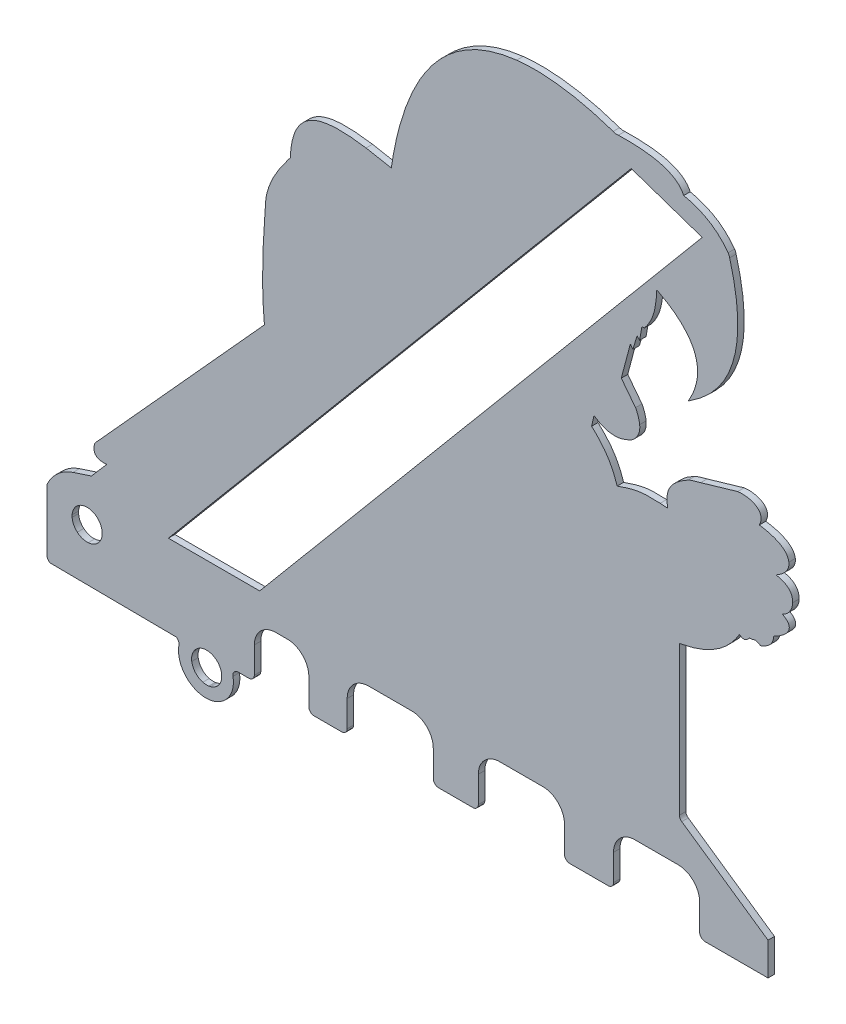
from build123d import *

# Parameters (mm, degrees)
RESSALTO_EXTRUS_O1_DEPTH = 6
ESCALA3_SCALE            = 3.29952381
CORTE_EXTRUS_O1_START    = -13.8
CORTE_EXTRUS_O1_DEPTH    = 13.8
ESBO_O6_W                = 30
ESBO_O6_H                = 66.574449876
CORTE_EXTRUS_O2_DEPTH    = 561.251044592


with BuildPart() as part:
    # Esboço1 → Ressalto-extrusão1 (new body)
    with BuildSketch(Plane.XY):
        with BuildLine():
            Line((-31.121249779, 70.172850718), (-31.713649779, 66.516050718))
            Line((-31.713649779, 66.516050718), (-38.818249779, 67.838550718))
            add(Edge.make_bspline(
                [(-38.818249779, 67.838550718), (-50.072449779, 69.533150718), (-59.326649779, 68.787550718), (-60.104449779, 55.530850718)],
                knots=[0.970588235, 0.970588235, 0.970588235, 0.970588235, 0.980392157, 0.980392157, 0.980392157, 0.980392157], degree=3))
            add(Edge.make_bspline(
                [(-60.104449779, 55.530850718), (-60.159849779, 54.587250718), (-60.019149779, 54.943050718), (-60.550849779, 54.270750718)],
                knots=[0.960784314, 0.960784314, 0.960784314, 0.960784314, 0.970588235, 0.970588235, 0.970588235, 0.970588235], degree=3))
            add(Edge.make_bspline(
                [(-60.550849779, 54.270750718), (-63.682849779, 50.310450718), (-67.043949779, 45.043350718), (-67.148049779, 39.827950718)],
                knots=[0.950980392, 0.950980392, 0.950980392, 0.950980392, 0.960784314, 0.960784314, 0.960784314, 0.960784314], degree=3))
            Line((-67.148049779, 39.827950718), (-67.319449779, 37.295950718))
            add(Edge.make_bspline(
                [(-67.319449779, 37.295950718), (-68.012149779, 28.365950718), (-68.286449779, 19.321950718), (-67.445149779, 10.391650718)],
                knots=[0.931372549, 0.931372549, 0.931372549, 0.931372549, 0.941176471, 0.941176471, 0.941176471, 0.941176471], degree=3))
            Line((-67.445149779, 10.391650718), (-115.167449779, -42.274749282))
            Line((-115.167449779, -42.274749282), (-115.235549779, -42.487349282))
            add(Edge.make_bspline(
                [(-115.235549779, -42.487349282), (-116.043149779, -45.186949282), (-114.385149779, -46.118649282), (-111.823249779, -45.803749282)],
                knots=[0.901960784, 0.901960784, 0.901960784, 0.901960784, 0.911764706, 0.911764706, 0.911764706, 0.911764706], degree=3))
            Line((-111.823249779, -45.803749282), (-116.159149779, -50.830249282))
            Line((-116.159149779, -50.830249282), (-121.346949779, -52.530849282))
            add(Edge.make_bspline(
                [(-121.346949779, -52.530849282), (-124.598549779, -53.596749282), (-127.260549779, -55.993749282), (-128.653149779, -59.137049282)],
                knots=[0.87254902, 0.87254902, 0.87254902, 0.87254902, 0.882352941, 0.882352941, 0.882352941, 0.882352941], degree=3))
            ThreePointArc((-128.653149779, -59.137049282), (-128.675107958, -59.186901913), (-128.696849779, -59.236849282))
            Line((-128.696849779, -59.236849282), (-128.696849779, -76.421849282))
            add(Edge.make_bspline(
                [(-128.696849779, -76.421849282), (-128.696649779, -77.043349282), (-128.316849779, -77.602649282), (-127.738849779, -77.831049282)],
                knots=[0.843137255, 0.843137255, 0.843137255, 0.843137255, 0.852941176, 0.852941176, 0.852941176, 0.852941176], degree=3))
            Line((-127.738849779, -77.831049282), (-92.253149779, -78.140649282))
            add(Edge.make_bspline(
                [(-92.253149779, -78.140649282), (-91.983949779, -78.214149282), (-91.374449779, -78.913749282), (-91.520449779, -79.721949282)],
                knots=[0.823529412, 0.823529412, 0.823529412, 0.823529412, 0.833333333, 0.833333333, 0.833333333, 0.833333333], degree=3))
            add(Edge.make_bspline(
                [(-91.520449779, -79.721949282), (-92.227549779, -83.635649282), (-89.831149779, -87.528149282), (-85.889449779, -88.569949282)],
                knots=[0.81372549, 0.81372549, 0.81372549, 0.81372549, 0.823529412, 0.823529412, 0.823529412, 0.823529412], degree=3))
            add(Edge.make_bspline(
                [(-85.889449779, -88.569949282), (-80.473149779, -90.001549282), (-75.316749779, -85.331049282), (-76.300749779, -79.751649282)],
                knots=[0.803921569, 0.803921569, 0.803921569, 0.803921569, 0.81372549, 0.81372549, 0.81372549, 0.81372549], degree=3))
            add(Edge.make_bspline(
                [(-76.300749779, -79.751649282), (-76.465049779, -78.819949282), (-75.745549779, -77.972749282), (-74.808549779, -77.972749282)],
                knots=[0.794117647, 0.794117647, 0.794117647, 0.794117647, 0.803921569, 0.803921569, 0.803921569, 0.803921569], degree=3))
            Line((-74.808549779, -77.972749282), (-71.800449779, -77.972749282))
            add(Edge.make_bspline(
                [(-71.800449779, -77.972749282), (-70.963649779, -77.972449282), (-70.284849779, -77.294349282), (-70.285049779, -76.457349282)],
                knots=[0.774509804, 0.774509804, 0.774509804, 0.774509804, 0.784313725, 0.784313725, 0.784313725, 0.784313725], degree=3))
            Line((-70.285049779, -76.457349282), (-70.285049779, -69.069749282))
            add(Edge.make_bspline(
                [(-70.285049779, -69.069749282), (-70.286149779, -65.726949282), (-67.566249779, -63.009449282), (-64.223749779, -63.008449282)],
                knots=[0.754901961, 0.754901961, 0.754901961, 0.754901961, 0.764705882, 0.764705882, 0.764705882, 0.764705882], degree=3))
            Line((-64.223749779, -63.008449282), (-61.003649779, -63.008449282))
            add(Edge.make_bspline(
                [(-61.003649779, -63.008449282), (-57.660849779, -63.007349282), (-54.943249779, -65.727249282), (-54.942249779, -69.069749282)],
                knots=[0.735294118, 0.735294118, 0.735294118, 0.735294118, 0.745098039, 0.745098039, 0.745098039, 0.745098039], degree=3))
            Line((-54.942249779, -69.069749282), (-54.942249779, -76.457349282))
            add(Edge.make_bspline(
                [(-54.942249779, -76.457349282), (-54.941949779, -77.294249282), (-54.263849779, -77.972949282), (-53.426949779, -77.972749282)],
                knots=[0.715686275, 0.715686275, 0.715686275, 0.715686275, 0.725490196, 0.725490196, 0.725490196, 0.725490196], degree=3))
            Line((-53.426949779, -77.972749282), (-45.660749779, -77.972749282))
            add(Edge.make_bspline(
                [(-45.660749779, -77.972749282), (-44.823949779, -77.972449282), (-44.145149779, -77.294349282), (-44.145449779, -76.457349282)],
                knots=[0.696078431, 0.696078431, 0.696078431, 0.696078431, 0.705882353, 0.705882353, 0.705882353, 0.705882353], degree=3))
            Line((-44.145449779, -76.457349282), (-44.145449779, -69.069749282))
            add(Edge.make_bspline(
                [(-44.145449779, -69.069749282), (-44.146449779, -65.726949282), (-41.426649779, -63.009449282), (-38.084049779, -63.008449282)],
                knots=[0.676470588, 0.676470588, 0.676470588, 0.676470588, 0.68627451, 0.68627451, 0.68627451, 0.68627451], degree=3))
            Line((-38.084049779, -63.008449282), (-25.961349779, -63.008449282))
            add(Edge.make_bspline(
                [(-25.961349779, -63.008449282), (-22.618649779, -63.007349282), (-19.901049779, -65.727149282), (-19.900049779, -69.069749282)],
                knots=[0.656862745, 0.656862745, 0.656862745, 0.656862745, 0.666666667, 0.666666667, 0.666666667, 0.666666667], degree=3))
            Line((-19.900049779, -69.069749282), (-19.900049779, -76.457349282))
            add(Edge.make_bspline(
                [(-19.900049779, -76.457349282), (-19.899749779, -77.294149282), (-19.221649779, -77.972949282), (-18.384649779, -77.972749282)],
                knots=[0.637254902, 0.637254902, 0.637254902, 0.637254902, 0.647058824, 0.647058824, 0.647058824, 0.647058824], degree=3))
            Line((-18.384649779, -77.972749282), (-8.724349779, -77.972749282))
            add(Edge.make_bspline(
                [(-8.724349779, -77.972749282), (-7.887549779, -77.972449282), (-7.208749779, -77.294249282), (-7.209049779, -76.457349282)],
                knots=[0.617647059, 0.617647059, 0.617647059, 0.617647059, 0.62745098, 0.62745098, 0.62745098, 0.62745098], degree=3))
            Line((-7.209049779, -76.457349282), (-7.209049779, -69.069749282))
            add(Edge.make_bspline(
                [(-7.209049779, -69.069749282), (-7.210049779, -65.726949282), (-4.490249779, -63.009449282), (-1.147649779, -63.008449282)],
                knots=[0.598039216, 0.598039216, 0.598039216, 0.598039216, 0.607843137, 0.607843137, 0.607843137, 0.607843137], degree=3))
            Line((-1.147649779, -63.008449282), (10.975050221, -63.008449282))
            add(Edge.make_bspline(
                [(10.975050221, -63.008449282), (14.317850221, -63.007349282), (17.035450221, -65.727149282), (17.036450221, -69.069749282)],
                knots=[0.578431373, 0.578431373, 0.578431373, 0.578431373, 0.588235294, 0.588235294, 0.588235294, 0.588235294], degree=3))
            Line((17.036450221, -69.069749282), (17.036450221, -76.457349282))
            add(Edge.make_bspline(
                [(17.036450221, -76.457349282), (17.036750221, -77.294349282), (17.714850221, -77.972949282), (18.551850221, -77.972749282)],
                knots=[0.558823529, 0.558823529, 0.558823529, 0.558823529, 0.568627451, 0.568627451, 0.568627451, 0.568627451], degree=3))
            Line((18.551850221, -77.972749282), (29.348650221, -77.972749282))
            add(Edge.make_bspline(
                [(29.348650221, -77.972749282), (30.185450221, -77.972449282), (30.864250221, -77.294249282), (30.863950221, -76.457349282)],
                knots=[0.539215686, 0.539215686, 0.539215686, 0.539215686, 0.549019608, 0.549019608, 0.549019608, 0.549019608], degree=3))
            Line((30.863950221, -76.457349282), (30.863950221, -69.069749282))
            add(Edge.make_bspline(
                [(30.863950221, -69.069749282), (30.862950221, -65.726949282), (33.582750221, -63.009449282), (36.925350221, -63.008449282)],
                knots=[0.519607843, 0.519607843, 0.519607843, 0.519607843, 0.529411765, 0.529411765, 0.529411765, 0.529411765], degree=3))
            Line((36.925350221, -63.008449282), (49.048050221, -63.008449282))
            add(Edge.make_bspline(
                [(49.048050221, -63.008449282), (52.390850221, -63.007349282), (55.108450221, -65.727149282), (55.109450221, -69.069749282)],
                knots=[0.5, 0.5, 0.5, 0.5, 0.509803922, 0.509803922, 0.509803922, 0.509803922], degree=3))
            Line((55.109450221, -69.069749282), (55.109450221, -76.457349282))
            add(Edge.make_bspline(
                [(55.109450221, -76.457349282), (55.109750221, -77.294349282), (55.787850221, -77.972949282), (56.624850221, -77.972749282)],
                knots=[0.480392157, 0.480392157, 0.480392157, 0.480392157, 0.490196078, 0.490196078, 0.490196078, 0.490196078], degree=3))
            Line((56.624850221, -77.972749282), (74.904750221, -77.972749282))
            add(Edge.make_bspline(
                [(74.904750221, -77.972749282), (75.741450221, -77.972449282), (76.420350221, -77.294249282), (76.420050221, -76.457349282)],
                knots=[0.460784314, 0.460784314, 0.460784314, 0.460784314, 0.470588235, 0.470588235, 0.470588235, 0.470588235], degree=3))
            Line((76.420050221, -76.457349282), (76.420050221, -70.953349282))
            add(Edge.make_bspline(
                [(76.420050221, -70.953349282), (76.419950221, -70.455449282), (76.175250221, -69.988849282), (75.765350221, -69.706149282)],
                knots=[0.441176471, 0.441176471, 0.441176471, 0.441176471, 0.450980392, 0.450980392, 0.450980392, 0.450980392], degree=3))
            Line((75.765350221, -69.706149282), (50.081650221, -51.982849282))
            add(Edge.make_bspline(
                [(50.081650221, -51.982849282), (49.671450221, -51.699949282), (49.427050221, -51.233849282), (49.426950221, -50.735649282)],
                knots=[0.421568627, 0.421568627, 0.421568627, 0.421568627, 0.431372549, 0.431372549, 0.431372549, 0.431372549], degree=3))
            Line((49.426950221, -50.735649282), (49.426950221, -8.859949282))
            add(Edge.make_bspline(
                [(49.426950221, -8.859949282), (56.517950221, -7.598549282), (62.555550221, -4.590949282), (66.306450221, 1.771350718)],
                knots=[0.401960784, 0.401960784, 0.401960784, 0.401960784, 0.411764706, 0.411764706, 0.411764706, 0.411764706], degree=3))
            add(Edge.make_bspline(
                [(66.306450221, 1.771350718), (67.595350221, 0.892850718), (68.287750221, 1.220950718), (69.130050221, 2.343750718)],
                knots=[0.392156863, 0.392156863, 0.392156863, 0.392156863, 0.401960784, 0.401960784, 0.401960784, 0.401960784], degree=3))
            Line((69.130050221, 2.343750718), (69.585250221, 2.334350718))
            add(Edge.make_bspline(
                [(69.585250221, 2.334350718), (70.765450221, 2.485950718), (70.617850221, 2.936950718), (71.799250221, 2.258550718)],
                knots=[0.37254902, 0.37254902, 0.37254902, 0.37254902, 0.382352941, 0.382352941, 0.382352941, 0.382352941], degree=3))
            add(Edge.make_bspline(
                [(71.799250221, 2.258550718), (72.272750221, 1.986650718), (72.275250221, 2.015950718), (72.629850221, 2.162650718)],
                knots=[0.362745098, 0.362745098, 0.362745098, 0.362745098, 0.37254902, 0.37254902, 0.37254902, 0.37254902], degree=3))
            add(Edge.make_bspline(
                [(72.629850221, 2.162650718), (74.577350221, 2.968350718), (75.783350221, 4.027050718), (75.988750221, 6.177550718)],
                knots=[0.352941176, 0.352941176, 0.352941176, 0.352941176, 0.362745098, 0.362745098, 0.362745098, 0.362745098], degree=3))
            add(Edge.make_bspline(
                [(75.988750221, 6.177550718), (78.686850221, 7.524050718), (82.841750221, 10.487450718), (78.378950221, 12.790950718)],
                knots=[0.343137255, 0.343137255, 0.343137255, 0.343137255, 0.352941176, 0.352941176, 0.352941176, 0.352941176], degree=3))
            add(Edge.make_bspline(
                [(78.378950221, 12.790950718), (80.122450221, 13.492750718), (81.255750221, 15.173050718), (81.302150221, 17.012450718)],
                knots=[0.333333333, 0.333333333, 0.333333333, 0.333333333, 0.343137255, 0.343137255, 0.343137255, 0.343137255], degree=3))
            add(Edge.make_bspline(
                [(81.302150221, 17.012450718), (81.372450221, 19.798050718), (79.103550221, 21.115250718), (76.570050221, 21.441850718)],
                knots=[0.323529412, 0.323529412, 0.323529412, 0.323529412, 0.333333333, 0.333333333, 0.333333333, 0.333333333], degree=3))
            add(Edge.make_bspline(
                [(76.570050221, 21.441850718), (78.334950221, 22.386350718), (80.526750221, 24.098950718), (80.230150221, 26.371550718)],
                knots=[0.31372549, 0.31372549, 0.31372549, 0.31372549, 0.323529412, 0.323529412, 0.323529412, 0.323529412], degree=3))
            add(Edge.make_bspline(
                [(80.230150221, 26.371550718), (79.788450221, 29.755850718), (74.611850221, 30.906250718), (71.917750221, 31.276850718)],
                knots=[0.303921569, 0.303921569, 0.303921569, 0.303921569, 0.31372549, 0.31372549, 0.31372549, 0.31372549], degree=3))
            add(Edge.make_bspline(
                [(71.917750221, 31.276850718), (74.034950221, 35.606650718), (68.750550221, 36.831950718), (65.823950221, 36.382650718)],
                knots=[0.294117647, 0.294117647, 0.294117647, 0.294117647, 0.303921569, 0.303921569, 0.303921569, 0.303921569], degree=3))
            Line((65.823950221, 36.382650718), (55.395850221, 33.337550718))
            add(Edge.make_bspline(
                [(55.395850221, 33.337550718), (54.625550221, 33.110050718), (52.599450221, 32.594050718), (51.931650221, 32.241250718)],
                knots=[0.274509804, 0.274509804, 0.274509804, 0.274509804, 0.284313725, 0.284313725, 0.284313725, 0.284313725], degree=3))
            add(Edge.make_bspline(
                [(51.931650221, 32.241250718), (49.453950221, 30.932450718), (46.599750221, 28.905750718), (46.034750221, 25.965250718)],
                knots=[0.264705882, 0.264705882, 0.264705882, 0.264705882, 0.274509804, 0.274509804, 0.274509804, 0.274509804], degree=3))
            add(Edge.make_bspline(
                [(46.034750221, 25.965250718), (45.882550221, 25.172850718), (46.003950221, 23.147450718), (46.018250221, 22.454050718)],
                knots=[0.254901961, 0.254901961, 0.254901961, 0.254901961, 0.264705882, 0.264705882, 0.264705882, 0.264705882], degree=3))
            Line((46.018250221, 22.454050718), (43.983450221, 22.605150718))
            add(Edge.make_bspline(
                [(43.983450221, 22.605150718), (38.652650221, 22.914750718), (36.769250221, 22.455950718), (31.887150221, 20.746750718)],
                knots=[0.235294118, 0.235294118, 0.235294118, 0.235294118, 0.245098039, 0.245098039, 0.245098039, 0.245098039], degree=3))
            add(Edge.make_bspline(
                [(31.887150221, 20.746750718), (30.470550221, 25.364050718), (28.225350221, 28.490950718), (24.690850221, 31.737650718)],
                knots=[0.225490196, 0.225490196, 0.225490196, 0.225490196, 0.235294118, 0.235294118, 0.235294118, 0.235294118], degree=3))
            Line((24.690850221, 31.737650718), (25.359350221, 34.694650718))
            add(Edge.make_bspline(
                [(25.359350221, 34.694650718), (27.518050221, 33.215250718), (29.647750221, 32.404850718), (32.279950221, 32.743250718)],
                knots=[0.205882353, 0.205882353, 0.205882353, 0.205882353, 0.215686275, 0.215686275, 0.215686275, 0.215686275], degree=3))
            add(Edge.make_bspline(
                [(32.279950221, 32.743250718), (33.476050221, 32.897050718), (35.582850221, 33.675750718), (36.414050221, 34.399650718)],
                knots=[0.196078431, 0.196078431, 0.196078431, 0.196078431, 0.205882353, 0.205882353, 0.205882353, 0.205882353], degree=3))
            add(Edge.make_bspline(
                [(36.414050221, 34.399650718), (37.776150221, 35.585950718), (38.411150221, 37.094150718), (38.224150221, 38.906050718)],
                knots=[0.18627451, 0.18627451, 0.18627451, 0.18627451, 0.196078431, 0.196078431, 0.196078431, 0.196078431], degree=3))
            add(Edge.make_bspline(
                [(38.224150221, 38.906050718), (38.120450221, 39.911050718), (37.549250221, 41.668350718), (37.056550221, 42.456950718)],
                knots=[0.176470588, 0.176470588, 0.176470588, 0.176470588, 0.18627451, 0.18627451, 0.18627451, 0.18627451], degree=3))
            Line((37.056550221, 42.456950718), (33.045650221, 47.654850718))
            Line((33.045650221, 47.654850718), (35.603150221, 57.281850718))
            Line((35.603150221, 57.281850718), (36.313750221, 56.291550718))
            Line((36.313750221, 56.291550718), (37.492650221, 60.215050718))
            Line((37.492650221, 60.215050718), (38.219150221, 59.459050718))
            Line((38.219150221, 59.459050718), (38.839950221, 63.126450718))
            Line((38.839950221, 63.126450718), (39.560450221, 63.136050718))
            add(Edge.make_bspline(
                [(39.560450221, 63.136050718), (42.325850221, 66.456550718), (42.866450221, 70.004450718), (43.040750221, 74.190650718)],
                knots=[0.098039216, 0.098039216, 0.098039216, 0.098039216, 0.107843137, 0.107843137, 0.107843137, 0.107843137], degree=3))
            add(Edge.make_bspline(
                [(43.040750221, 74.190650718), (45.462150221, 72.939250718), (47.699050221, 71.580650718), (49.720450221, 69.733250718)],
                knots=[0.088235294, 0.088235294, 0.088235294, 0.088235294, 0.098039216, 0.098039216, 0.098039216, 0.098039216], degree=3))
            add(Edge.make_bspline(
                [(49.720450221, 69.733250718), (55.600550221, 64.359250718), (55.804050221, 58.206750718), (51.907250221, 51.521650718)],
                knots=[0.078431373, 0.078431373, 0.078431373, 0.078431373, 0.088235294, 0.088235294, 0.088235294, 0.088235294], degree=3))
            Line((51.907250221, 51.521650718), (52.345950221, 51.797250718))
            add(Edge.make_bspline(
                [(52.345950221, 51.797250718), (67.151550221, 61.249250718), (67.845550221, 76.715050718), (63.564350221, 92.234350718)],
                knots=[0.058823529, 0.058823529, 0.058823529, 0.058823529, 0.068627451, 0.068627451, 0.068627451, 0.068627451], degree=3))
            add(Edge.make_bspline(
                [(63.564350221, 92.234350718), (63.385650221, 92.882150718), (63.470850221, 92.753150718), (63.117550221, 93.244250718)],
                knots=[0.049019608, 0.049019608, 0.049019608, 0.049019608, 0.058823529, 0.058823529, 0.058823529, 0.058823529], degree=3))
            add(Edge.make_bspline(
                [(63.117550221, 93.244250718), (59.995850221, 97.583250718), (55.771050221, 99.880350718), (50.619750221, 100.968250718)],
                knots=[0.039215686, 0.039215686, 0.039215686, 0.039215686, 0.049019608, 0.049019608, 0.049019608, 0.049019608], degree=3))
            add(Edge.make_bspline(
                [(50.619750221, 100.968250718), (48.150050221, 106.591350718), (37.305050221, 106.596650718), (32.229050221, 106.479550718)],
                knots=[0.029411765, 0.029411765, 0.029411765, 0.029411765, 0.039215686, 0.039215686, 0.039215686, 0.039215686], degree=3))
            add(Edge.make_bspline(
                [(32.229050221, 106.479550718), (31.235850221, 106.456650718), (31.636250221, 106.384850718), (30.763750221, 106.682050718)],
                knots=[0.019607843, 0.019607843, 0.019607843, 0.019607843, 0.029411765, 0.029411765, 0.029411765, 0.029411765], degree=3))
            add(Edge.make_bspline(
                [(30.763750221, 106.682050718), (22.191550221, 109.602250718), (12.647650221, 111.495150718), (3.581250221, 110.462950718)],
                knots=[0.009803922, 0.009803922, 0.009803922, 0.009803922, 0.019607843, 0.019607843, 0.019607843, 0.019607843], degree=3))
            add(Edge.make_bspline(
                [(3.581250221, 110.462950718), (-18.228849779, 107.979850718), (-27.513649779, 89.973450718), (-31.121249779, 70.172850718)],
                knots=[0, 0, 0, 0, 0.009803922, 0.009803922, 0.009803922, 0.009803922], degree=3))
        make_face()
        Polygon((35.847250221, 100.175950718), (-94.491749779, -55.146649282), (-68.768049779, -55.146649282), (55.841150221, 93.356950718), align=None, mode=Mode.SUBTRACT)
        with BuildLine():
            ThreePointArc((-113.127049779, -63.008449282), (-113.128159804, -62.992346427), (-113.129349779, -62.976249282))
            add(Edge.make_bspline(
                [(-113.129349779, -62.976249282), (-113.212649779, -61.853249282), (-113.738749779, -60.809449282), (-114.591749779, -60.074449282)],
                knots=[0.625, 0.625, 0.625, 0.625, 0.75, 0.75, 0.75, 0.75], degree=3))
            add(Edge.make_bspline(
                [(-114.591749779, -60.074449282), (-115.444649779, -59.339349282), (-116.549449779, -58.972849282), (-117.672349779, -59.056149282)],
                knots=[0.75, 0.75, 0.75, 0.75, 0.875, 0.875, 0.875, 0.875], degree=3))
            add(Edge.make_bspline(
                [(-117.672349779, -59.056149282), (-119.783349779, -59.212649282), (-121.456249779, -60.896149282), (-121.594549779, -63.008449282)],
                knots=[0.875, 0.875, 0.875, 0.875, 1, 1, 1, 1], degree=3))
            ThreePointArc((-121.594549779, -63.008449282), (-121.603762276, -63.30383769), (-121.592349779, -63.599149282))
            add(Edge.make_bspline(
                [(-121.592349779, -63.599149282), (-121.508949779, -64.722149282), (-120.982949779, -65.765949282), (-120.129949779, -66.501049282)],
                knots=[0.125, 0.125, 0.125, 0.125, 0.25, 0.25, 0.25, 0.25], degree=3))
            add(Edge.make_bspline(
                [(-120.129949779, -66.501049282), (-119.276949779, -67.236049282), (-118.172249779, -67.602549282), (-117.049349779, -67.519249282)],
                knots=[0.25, 0.25, 0.25, 0.25, 0.375, 0.375, 0.375, 0.375], degree=3))
            add(Edge.make_bspline(
                [(-117.049349779, -67.519249282), (-114.723549779, -67.346549282), (-112.972149779, -65.335449282), (-113.127049779, -63.008449282)],
                knots=[0.375, 0.375, 0.375, 0.375, 0.5, 0.5, 0.5, 0.5], degree=3))
        make_face(mode=Mode.SUBTRACT)
        with BuildLine():
            ThreePointArc((-80.941149779, -78.086649282), (-81.032511413, -78.010664877), (-81.125949779, -77.937249282))
            add(Edge.make_bspline(
                [(-81.125949779, -77.937249282), (-82.025449779, -77.250949282), (-83.160849779, -76.952049282), (-84.281549779, -77.107149282)],
                knots=[0.722222222, 0.722222222, 0.722222222, 0.722222222, 0.777777778, 0.777777778, 0.777777778, 0.777777778], degree=3))
            ThreePointArc((-84.281549779, -77.107149282), (-84.690093286, -77.184282224), (-85.089149779, -77.300949282))
            ThreePointArc((-85.089149779, -77.300949282), (-85.542241743, -77.487895409), (-85.970749779, -77.725849282))
            ThreePointArc((-85.970749779, -77.725849282), (-86.124824579, -77.828211643), (-86.274249779, -77.937249282))
            ThreePointArc((-86.274249779, -77.937249282), (-86.427959615, -78.060222047), (-86.575749779, -78.190249282))
            add(Edge.make_bspline(
                [(-86.575749779, -78.190249282), (-87.597849779, -79.132649282), (-88.093849779, -80.514449282), (-87.903049779, -81.891549282)],
                knots=[0, 0, 0, 0, 0.055555556, 0.055555556, 0.055555556, 0.055555556], degree=3))
            add(Edge.make_bspline(
                [(-87.903049779, -81.891549282), (-87.668049779, -83.587049282), (-86.439849779, -84.974949282), (-84.784849779, -85.412049282)],
                knots=[0.055555556, 0.055555556, 0.055555556, 0.055555556, 0.111111111, 0.111111111, 0.111111111, 0.111111111], degree=3))
            ThreePointArc((-84.784849779, -85.412049282), (-83.956816784, -85.545309994), (-83.118749779, -85.513049282))
            add(Edge.make_bspline(
                [(-83.118749779, -85.513049282), (-83.042349779, -85.502549282), (-82.966349779, -85.489849282), (-82.890649779, -85.475149282)],
                knots=[0.166666667, 0.166666667, 0.166666667, 0.166666667, 0.222222222, 0.222222222, 0.222222222, 0.222222222], degree=3))
            ThreePointArc((-82.890649779, -85.475149282), (-82.697757765, -85.432989064), (-82.507049779, -85.381849282))
            ThreePointArc((-82.507049779, -85.381849282), (-81.926785387, -85.164712909), (-81.384349779, -84.865349282))
            add(Edge.make_bspline(
                [(-81.384349779, -84.865349282), (-80.574849779, -84.337949282), (-79.969649779, -83.550749282), (-79.668549779, -82.632749282)],
                knots=[0.333333333, 0.333333333, 0.333333333, 0.333333333, 0.388888889, 0.388888889, 0.388888889, 0.388888889], degree=3))
            ThreePointArc((-79.668549779, -82.632749282), (-79.474252126, -81.690525353), (-79.497149779, -80.728749282))
            ThreePointArc((-79.497149779, -80.728749282), (-79.606639726, -80.193865308), (-79.783849779, -79.677449282))
            ThreePointArc((-79.783849779, -79.677449282), (-79.862574672, -79.50022451), (-79.949249779, -79.326749282))
            ThreePointArc((-79.949249779, -79.326749282), (-80.316083047, -78.750659323), (-80.770549779, -78.240849282))
            ThreePointArc((-80.770549779, -78.240849282), (-80.854801161, -78.162589138), (-80.941149779, -78.086649282))
        make_face(mode=Mode.SUBTRACT)
    extrude(amount=RESSALTO_EXTRUS_O1_DEPTH)


with BuildPart() as part_1:
    # Escala3: scaled about (0, 0, 0)
    add(part.part.scale(ESCALA3_SCALE))

    # Esboço4 → Corte-extrusão1 (cut)
    with BuildSketch(Plane.XY.offset(19.79714286).offset(CORTE_EXTRUS_O1_START)):
        with BuildLine():
            Line((-102.685304643, 231.536991759), (-104.639942548, 219.47129309))
            Line((-104.639942548, 219.47129309), (-128.081739409, 223.834913329))
            add(Edge.make_bspline(
                [(-128.081739409, 223.834913329), (-165.215240271, 229.426286377), (-195.749693514, 226.966161425), (-198.316063133, 183.225364133)],
                knots=[0.970588235, 0.970588235, 0.970588235, 0.970588235, 0.980392157, 0.980392157, 0.980392157, 0.980392157], degree=3))
            add(Edge.make_bspline(
                [(-198.316063133, 183.225364133), (-198.498856752, 180.111933466), (-198.034613752, 181.285904037), (-199.788970562, 179.06763418)],
                knots=[0.960784314, 0.960784314, 0.960784314, 0.960784314, 0.970588235, 0.970588235, 0.970588235, 0.970588235], degree=3))
            add(Edge.make_bspline(
                [(-199.788970562, 179.06763418), (-210.123079135, 166.000530035), (-221.213108612, 148.621608175), (-221.556589041, 131.413271697)],
                knots=[0.950980392, 0.950980392, 0.950980392, 0.950980392, 0.960784314, 0.960784314, 0.960784314, 0.960784314], degree=3))
            Line((-221.556589041, 131.413271697), (-222.122127422, 123.05887741))
            add(Edge.make_bspline(
                [(-222.122127422, 123.05887741), (-224.407707565, 93.594129786), (-225.312766946, 63.753236449), (-222.536877565, 34.287498968)],
                knots=[0.931372549, 0.931372549, 0.931372549, 0.931372549, 0.941176471, 0.941176471, 0.941176471, 0.941176471], degree=3))
            Line((-222.536877565, 34.287498968), (-379.997742683, -139.486541819))
            Line((-379.997742683, -139.486541819), (-380.222440254, -140.188020581))
            add(Edge.make_bspline(
                [(-380.222440254, -140.188020581), (-382.887135683, -149.095415058), (-377.416525206, -152.169581392), (-368.963475158, -151.130561344)],
                knots=[0.901960784, 0.901960784, 0.901960784, 0.901960784, 0.911764706, 0.911764706, 0.911764706, 0.911764706], degree=3))
            Line((-368.963475158, -151.130561344), (-383.269880445, -167.715617775))
            Line((-383.269880445, -167.715617775), (-400.387150067, -173.326787966))
            add(Edge.make_bspline(
                [(-400.387150067, -173.326787966), (-411.115881687, -176.843750396), (-419.89921407, -184.752708968), (-424.494130927, -195.12410216)],
                knots=[0.87254902, 0.87254902, 0.87254902, 0.87254902, 0.882352941, 0.882352941, 0.882352941, 0.882352941], degree=3))
            ThreePointArc((-424.494130927, -195.12410216), (-424.566582461, -195.288592104), (-424.638320118, -195.453394636))
            Line((-424.638320118, -195.453394636), (-424.638320118, -252.155711311))
            add(Edge.make_bspline(
                [(-424.638320118, -252.155711311), (-424.637660213, -254.206365359), (-423.38450107, -256.051789026), (-421.477376308, -256.805400264)],
                knots=[0.843137255, 0.843137255, 0.843137255, 0.843137255, 0.852941176, 0.852941176, 0.852941176, 0.852941176], degree=3))
            Line((-421.477376308, -256.805400264), (-304.391464243, -257.826932836))
            add(Edge.make_bspline(
                [(-304.391464243, -257.826932836), (-303.503232434, -258.069447836), (-301.492172672, -260.377794693), (-301.973903148, -263.044469837)],
                knots=[0.823529412, 0.823529412, 0.823529412, 0.823529412, 0.833333333, 0.833333333, 0.833333333, 0.833333333], degree=3))
            add(Edge.make_bspline(
                [(-301.973903148, -263.044469837), (-304.306996434, -275.957816172), (-296.400017576, -288.801212602), (-283.394284574, -292.238656507)],
                knots=[0.81372549, 0.81372549, 0.81372549, 0.81372549, 0.823529412, 0.823529412, 0.823529412, 0.823529412], degree=3))
            add(Edge.make_bspline(
                [(-283.394284574, -292.238656507), (-265.523073762, -296.962254794), (-248.509409188, -281.551828839), (-251.756140617, -263.142465694)],
                knots=[0.803921569, 0.803921569, 0.803921569, 0.803921569, 0.81372549, 0.81372549, 0.81372549, 0.81372549], degree=3))
            add(Edge.make_bspline(
                [(-251.756140617, -263.142465694), (-252.298252379, -260.06829936), (-249.924244998, -257.272942788), (-246.832591188, -257.272942788)],
                knots=[0.794117647, 0.794117647, 0.794117647, 0.794117647, 0.803921569, 0.803921569, 0.803921569, 0.803921569], degree=3))
            Line((-246.832591188, -257.272942788), (-236.907293615, -257.272942788))
            add(Edge.make_bspline(
                [(-236.907293615, -257.272942788), (-234.14625209, -257.271952931), (-231.906535328, -255.034545835), (-231.907195233, -252.272844406)],
                knots=[0.774509804, 0.774509804, 0.774509804, 0.774509804, 0.784313725, 0.784313725, 0.784313725, 0.784313725], degree=3))
            Line((-231.907195233, -252.272844406), (-231.907195233, -227.897282308))
            add(Edge.make_bspline(
                [(-231.907195233, -227.897282308), (-231.910824709, -216.867634116), (-222.936449898, -207.901178162), (-211.907791563, -207.897878638)],
                knots=[0.754901961, 0.754901961, 0.754901961, 0.754901961, 0.764705882, 0.764705882, 0.764705882, 0.764705882], degree=3))
            Line((-211.907791563, -207.897878638), (-201.282994943, -207.897878638))
            add(Edge.make_bspline(
                [(-201.282994943, -207.897878638), (-190.253346751, -207.894249162), (-181.286560845, -216.868623973), (-181.283261321, -227.897282308)],
                knots=[0.735294118, 0.735294118, 0.735294118, 0.735294118, 0.745098039, 0.745098039, 0.745098039, 0.745098039], degree=3))
            Line((-181.283261321, -227.897282308), (-181.283261321, -252.272844406))
            add(Edge.make_bspline(
                [(-181.283261321, -252.272844406), (-181.282271464, -255.034215883), (-179.044864368, -257.273602693), (-176.283492892, -257.272942788)],
                knots=[0.715686275, 0.715686275, 0.715686275, 0.715686275, 0.725490196, 0.725490196, 0.725490196, 0.725490196], degree=3))
            Line((-176.283492892, -257.272942788), (-150.658731078, -257.272942788))
            add(Edge.make_bspline(
                [(-150.658731078, -257.272942788), (-147.897689554, -257.271952931), (-145.657972792, -255.034545835), (-145.658962649, -252.272844406)],
                knots=[0.696078431, 0.696078431, 0.696078431, 0.696078431, 0.705882353, 0.705882353, 0.705882353, 0.705882353], degree=3))
            Line((-145.658962649, -252.272844406), (-145.658962649, -227.897282308))
            add(Edge.make_bspline(
                [(-145.658962649, -227.897282308), (-145.662262173, -216.867634116), (-136.688217315, -207.901178162), (-125.659229027, -207.897878638)],
                knots=[0.676470588, 0.676470588, 0.676470588, 0.676470588, 0.68627451, 0.68627451, 0.68627451, 0.68627451], degree=3))
            Line((-125.659229027, -207.897878638), (-85.660091736, -207.897878638))
            add(Edge.make_bspline(
                [(-85.660091736, -207.897878638), (-74.630773496, -207.894249162), (-65.66398759, -216.86829402), (-65.660688066, -227.897282308)],
                knots=[0.656862745, 0.656862745, 0.656862745, 0.656862745, 0.666666667, 0.666666667, 0.666666667, 0.666666667], degree=3))
            Line((-65.660688066, -227.897282308), (-65.660688066, -252.272844406))
            add(Edge.make_bspline(
                [(-65.660688066, -252.272844406), (-65.659698209, -255.033885931), (-63.422291113, -257.273602693), (-60.660589684, -257.272942788)],
                knots=[0.637254902, 0.637254902, 0.637254902, 0.637254902, 0.647058824, 0.647058824, 0.647058824, 0.647058824], degree=3))
            Line((-60.660589684, -257.272942788), (-28.786199823, -257.272942788))
            add(Edge.make_bspline(
                [(-28.786199823, -257.272942788), (-26.025158299, -257.271952931), (-23.785441536, -255.034215883), (-23.786431393, -252.272844406)],
                knots=[0.617647059, 0.617647059, 0.617647059, 0.617647059, 0.62745098, 0.62745098, 0.62745098, 0.62745098], degree=3))
            Line((-23.786431393, -252.272844406), (-23.786431393, -227.897282308))
            add(Edge.make_bspline(
                [(-23.786431393, -227.897282308), (-23.789730917, -216.867634116), (-14.815686059, -207.901178162), (-3.786697772, -207.897878638)],
                knots=[0.598039216, 0.598039216, 0.598039216, 0.598039216, 0.607843137, 0.607843137, 0.607843137, 0.607843137], degree=3))
            Line((-3.786697772, -207.897878638), (36.21243952, -207.897878638))
            add(Edge.make_bspline(
                [(36.21243952, -207.897878638), (47.242087712, -207.894249162), (56.208873618, -216.86829402), (56.212173142, -227.897282308)],
                knots=[0.578431373, 0.578431373, 0.578431373, 0.578431373, 0.588235294, 0.588235294, 0.588235294, 0.588235294], degree=3))
            Line((56.212173142, -227.897282308), (56.212173142, -252.272844406))
            add(Edge.make_bspline(
                [(56.212173142, -252.272844406), (56.213162999, -255.034545835), (58.450570095, -257.273602693), (61.212271524, -257.272942788)],
                knots=[0.558823529, 0.558823529, 0.558823529, 0.558823529, 0.568627451, 0.568627451, 0.568627451, 0.568627451], degree=3))
            Line((61.212271524, -257.272942788), (96.836570195, -257.272942788))
            add(Edge.make_bspline(
                [(96.836570195, -257.272942788), (99.59761172, -257.271952931), (101.837328482, -255.034215883), (101.836338625, -252.272844406)],
                knots=[0.539215686, 0.539215686, 0.539215686, 0.539215686, 0.549019608, 0.549019608, 0.549019608, 0.549019608], degree=3))
            Line((101.836338625, -252.272844406), (101.836338625, -227.897282308))
            add(Edge.make_bspline(
                [(101.836338625, -227.897282308), (101.833039101, -216.867634116), (110.807083959, -207.901178162), (121.836072247, -207.897878638)],
                knots=[0.519607843, 0.519607843, 0.519607843, 0.519607843, 0.529411765, 0.529411765, 0.529411765, 0.529411765], degree=3))
            Line((121.836072247, -207.897878638), (161.835209538, -207.897878638))
            add(Edge.make_bspline(
                [(161.835209538, -207.897878638), (172.86485773, -207.894249162), (181.831643636, -216.86829402), (181.83494316, -227.897282308)],
                knots=[0.5, 0.5, 0.5, 0.5, 0.509803922, 0.509803922, 0.509803922, 0.509803922], degree=3))
            Line((181.83494316, -227.897282308), (181.83494316, -252.272844406))
            add(Edge.make_bspline(
                [(181.83494316, -252.272844406), (181.835933017, -255.034545835), (184.073340113, -257.273602693), (186.835041542, -257.272942788)],
                knots=[0.480392157, 0.480392157, 0.480392157, 0.480392157, 0.490196078, 0.490196078, 0.490196078, 0.490196078], degree=3))
            Line((186.835041542, -257.272942788), (247.150006836, -257.272942788))
            add(Edge.make_bspline(
                [(247.150006836, -257.272942788), (249.910718408, -257.271952931), (252.150765123, -255.034215883), (252.149775265, -252.272844406)],
                knots=[0.460784314, 0.460784314, 0.460784314, 0.460784314, 0.470588235, 0.470588235, 0.470588235, 0.470588235], degree=3))
            Line((252.149775265, -252.272844406), (252.149775265, -234.112265356))
            add(Edge.make_bspline(
                [(252.149775265, -234.112265356), (252.149445313, -232.469432451), (251.342051837, -230.929874641), (249.989577027, -229.99709926)],
                knots=[0.441176471, 0.441176471, 0.441176471, 0.441176471, 0.450980392, 0.450980392, 0.450980392, 0.450980392], degree=3))
            Line((249.989577027, -229.99709926), (165.245597348, -171.518648919))
            add(Edge.make_bspline(
                [(165.245597348, -171.518648919), (163.892132681, -170.585213633), (163.085729062, -169.047305585), (163.08539911, -167.403482823)],
                knots=[0.421568627, 0.421568627, 0.421568627, 0.421568627, 0.431372549, 0.431372549, 0.431372549, 0.431372549], degree=3))
            Line((163.08539911, -167.403482823), (163.08539911, -29.233613612))
            add(Edge.make_bspline(
                [(163.08539911, -29.233613612), (186.482322446, -25.071594278), (206.403527402, -15.147946467), (218.779711261, 5.844613869)],
                knots=[0.401960784, 0.401960784, 0.401960784, 0.401960784, 0.411764706, 0.411764706, 0.411764706, 0.411764706], degree=3))
            add(Edge.make_bspline(
                [(218.779711261, 5.844613869), (223.032467499, 2.945982202), (225.317057785, 4.028555964), (228.096246691, 7.733261298)],
                knots=[0.392156863, 0.392156863, 0.392156863, 0.392156863, 0.401960784, 0.401960784, 0.401960784, 0.401960784], degree=3))
            Line((228.096246691, 7.733261298), (229.598189929, 7.702245774))
            add(Edge.make_bspline(
                [(229.598189929, 7.702245774), (233.492287929, 8.202453584), (233.005278215, 9.690538822), (236.903335644, 7.452141869)],
                knots=[0.37254902, 0.37254902, 0.37254902, 0.37254902, 0.382352941, 0.382352941, 0.382352941, 0.382352941], degree=3))
            add(Edge.make_bspline(
                [(236.903335644, 7.452141869), (238.465660168, 6.555001345), (238.473908978, 6.651677393), (239.643920121, 7.135717536)],
                knots=[0.362745098, 0.362745098, 0.362745098, 0.362745098, 0.37254902, 0.37254902, 0.37254902, 0.37254902], degree=3))
            add(Edge.make_bspline(
                [(239.643920121, 7.135717536), (246.069742741, 9.794143869), (250.048968456, 13.287349727), (250.726690646, 20.382975681)],
                knots=[0.352941176, 0.352941176, 0.352941176, 0.352941176, 0.362745098, 0.362745098, 0.362745098, 0.362745098], degree=3))
            add(Edge.make_bspline(
                [(250.726690646, 20.382975681), (259.629135838, 24.825784491), (273.338327316, 34.603593349), (258.613212457, 42.204046446)],
                knots=[0.343137255, 0.343137255, 0.343137255, 0.343137255, 0.352941176, 0.352941176, 0.352941176, 0.352941176], degree=3))
            add(Edge.make_bspline(
                [(258.613212457, 42.204046446), (264.36593222, 44.519652255), (268.105282553, 50.063842113), (268.258380458, 56.13298621)],
                knots=[0.333333333, 0.333333333, 0.333333333, 0.333333333, 0.343137255, 0.343137255, 0.343137255, 0.343137255], degree=3))
            add(Edge.make_bspline(
                [(268.258380458, 56.13298621), (268.490336982, 65.324139735), (261.00404741, 69.670272497), (252.644703837, 70.747896974)],
                knots=[0.323529412, 0.323529412, 0.323529412, 0.323529412, 0.333333333, 0.333333333, 0.333333333, 0.333333333], degree=3))
            add(Edge.make_bspline(
                [(252.644703837, 70.747896974), (258.468033409, 73.864297212), (265.699929696, 79.515061689), (264.721290934, 87.0135595)],
                knots=[0.31372549, 0.31372549, 0.31372549, 0.31372549, 0.323529412, 0.323529412, 0.323529412, 0.323529412], degree=3))
            add(Edge.make_bspline(
                [(264.721290934, 87.0135595), (263.263891267, 98.18013793), (246.183576312, 101.975910121), (237.294329216, 103.198713645)],
                knots=[0.303921569, 0.303921569, 0.303921569, 0.303921569, 0.31372549, 0.31372549, 0.31372549, 0.31372549], degree=3))
            add(Edge.make_bspline(
                [(237.294329216, 103.198713645), (244.280081026, 117.484991837), (226.844077405, 121.527898362), (217.187691022, 120.045422314)],
                knots=[0.294117647, 0.294117647, 0.294117647, 0.294117647, 0.303921569, 0.303921569, 0.303921569, 0.303921569], degree=3))
            Line((217.187691022, 120.045422314), (182.779926779, 109.99804236))
            add(Edge.make_bspline(
                [(182.779926779, 109.99804236), (180.238303588, 109.247400693), (173.553138397, 107.544846407), (171.349716397, 106.380774407)],
                knots=[0.274509804, 0.274509804, 0.274509804, 0.274509804, 0.284313725, 0.284313725, 0.284313725, 0.284313725], degree=3))
            add(Edge.make_bspline(
                [(171.349716397, 106.380774407), (163.174486253, 102.062357645), (153.756985394, 95.375212739), (151.892754441, 85.672962976)],
                knots=[0.264705882, 0.264705882, 0.264705882, 0.264705882, 0.274509804, 0.274509804, 0.274509804, 0.274509804], degree=3))
            add(Edge.make_bspline(
                [(151.892754441, 85.672962976), (151.390566918, 83.058420309), (151.791129108, 76.375564784), (151.838312299, 74.087674974)],
                knots=[0.254901961, 0.254901961, 0.254901961, 0.254901961, 0.264705882, 0.264705882, 0.264705882, 0.264705882], degree=3))
            Line((151.838312299, 74.087674974), (145.12444125, 74.586233022))
            add(Edge.make_bspline(
                [(145.12444125, 74.586233022), (127.535339724, 75.607765593), (121.32101658, 74.093944069), (105.212411387, 68.454397973)],
                knots=[0.235294118, 0.235294118, 0.235294118, 0.235294118, 0.245098039, 0.245098039, 0.245098039, 0.245098039], degree=3))
            add(Edge.make_bspline(
                [(105.212411387, 68.454397973), (100.538305958, 83.689289261), (93.1302151, 94.006570263), (81.468048193, 104.719134217)],
                knots=[0.225490196, 0.225490196, 0.225490196, 0.225490196, 0.235294118, 0.235294118, 0.235294118, 0.235294118], degree=3))
            Line((81.468048193, 104.719134217), (83.67377986, 114.475826123))
            add(Edge.make_bspline(
                [(83.67377986, 114.475826123), (90.796461909, 109.594510598), (97.823457767, 106.920576503), (106.50846434, 108.03713536)],
                knots=[0.205882353, 0.205882353, 0.205882353, 0.205882353, 0.215686275, 0.215686275, 0.215686275, 0.215686275], degree=3))
            add(Edge.make_bspline(
                [(106.50846434, 108.03713536), (110.455024769, 108.544602122), (117.406461532, 111.113941313), (120.149025723, 113.502466599)],
                knots=[0.196078431, 0.196078431, 0.196078431, 0.196078431, 0.205882353, 0.205882353, 0.205882353, 0.205882353], degree=3))
            add(Edge.make_bspline(
                [(120.149025723, 113.502466599), (124.643307104, 117.416691695), (126.738504724, 122.393033505), (126.121493771, 128.371440696)],
                knots=[0.18627451, 0.18627451, 0.18627451, 0.18627451, 0.196078431, 0.196078431, 0.196078431, 0.196078431], degree=3))
            add(Edge.make_bspline(
                [(126.121493771, 128.371440696), (125.779333152, 131.687462125), (123.894645152, 137.485715316), (122.26896977, 140.087719793)],
                knots=[0.176470588, 0.176470588, 0.176470588, 0.176470588, 0.18627451, 0.18627451, 0.18627451, 0.18627451], degree=3))
            Line((122.26896977, 140.087719793), (109.034909721, 157.238314605))
            Line((109.034909721, 157.238314605), (117.473441865, 189.002830324))
            Line((117.473441865, 189.002830324), (119.818083484, 185.735311895))
            Line((119.818083484, 185.735311895), (123.707892104, 198.680993563))
            Line((123.707892104, 198.680993563), (126.104996152, 196.186553563))
            Line((126.104996152, 196.186553563), (128.153340533, 208.287227184))
            Line((128.153340533, 208.287227184), (130.530647438, 208.318902612))
            add(Edge.make_bspline(
                [(130.530647438, 208.318902612), (139.655150583, 219.274971424), (141.438873154, 230.981351949), (142.013980154, 244.793818522)],
                knots=[0.098039216, 0.098039216, 0.098039216, 0.098039216, 0.107843137, 0.107843137, 0.107843137, 0.107843137], degree=3))
            add(Edge.make_bspline(
                [(142.013980154, 244.793818522), (150.003447108, 240.664794427), (157.384151918, 236.182061378), (164.053809348, 230.086521092)],
                knots=[0.088235294, 0.088235294, 0.088235294, 0.088235294, 0.098039216, 0.098039216, 0.098039216, 0.098039216], degree=3))
            add(Edge.make_bspline(
                [(164.053809348, 230.086521092), (183.455339303, 212.354880137), (184.126792398, 192.054559896), (171.269208016, 169.996913274)],
                knots=[0.078431373, 0.078431373, 0.078431373, 0.078431373, 0.088235294, 0.088235294, 0.088235294, 0.088235294], degree=3))
            Line((171.269208016, 169.996913274), (172.716709111, 170.906262036))
            add(Edge.make_bspline(
                [(172.716709111, 170.906262036), (221.568138832, 202.093361088), (223.858008357, 253.123136428), (209.732087021, 304.329436293)],
                knots=[0.058823529, 0.058823529, 0.058823529, 0.058823529, 0.068627451, 0.068627451, 0.068627451, 0.068627451], degree=3))
            add(Edge.make_bspline(
                [(209.732087021, 304.329436293), (209.142462116, 306.466867817), (209.423581545, 306.041229246), (208.257859783, 307.661625389)],
                knots=[0.049019608, 0.049019608, 0.049019608, 0.049019608, 0.058823529, 0.058823529, 0.058823529, 0.058823529], degree=3))
            add(Edge.make_bspline(
                [(208.257859783, 307.661625389), (197.957736305, 321.9782592), (184.017908113, 329.557595344), (167.02107111, 333.147147297)],
                knots=[0.039215686, 0.039215686, 0.039215686, 0.039215686, 0.049019608, 0.049019608, 0.049019608, 0.049019608], degree=3))
            add(Edge.make_bspline(
                [(167.02107111, 333.147147297), (158.872237157, 351.700699633), (123.088901437, 351.718187109), (106.340518578, 351.331812871)],
                knots=[0.029411765, 0.029411765, 0.029411765, 0.029411765, 0.039215686, 0.039215686, 0.039215686, 0.039215686], degree=3))
            add(Edge.make_bspline(
                [(106.340518578, 351.331812871), (103.06343153, 351.256253776), (104.384560863, 351.019347966), (101.505726339, 351.999966443)],
                knots=[0.019607843, 0.019607843, 0.019607843, 0.019607843, 0.029411765, 0.029411765, 0.029411765, 0.029411765], degree=3))
            add(Edge.make_bspline(
                [(101.505726339, 351.999966443), (73.221548335, 361.635235873), (41.731223045, 367.880904493), (11.816420374, 364.475136016)],
                knots=[0.009803922, 0.009803922, 0.009803922, 0.009803922, 0.019607843, 0.019607843, 0.019607843, 0.019607843], degree=3))
            add(Edge.make_bspline(
                [(11.816420374, 364.475136016), (-60.146523875, 356.282088443), (-90.781942546, 296.869542911), (-102.685304643, 231.536991759)],
                knots=[0, 0, 0, 0, 0.009803922, 0.009803922, 0.009803922, 0.009803922], degree=3))
        make_face()
    extrude(amount=CORTE_EXTRUS_O1_DEPTH, mode=Mode.SUBTRACT)

    # Esboço6 → Corte-extrusão2 (cut, through all)
    with BuildSketch(Plane(origin=(0, 0, 0), x_dir=(-1, 0, 0), z_dir=(0, 0, -1))):
        with Locations((-260.361679882, -240.560167726)):
            Rectangle(ESBO_O6_W, ESBO_O6_H)
    extrude(amount=-CORTE_EXTRUS_O2_DEPTH, mode=Mode.SUBTRACT)


solid = part_1.part
